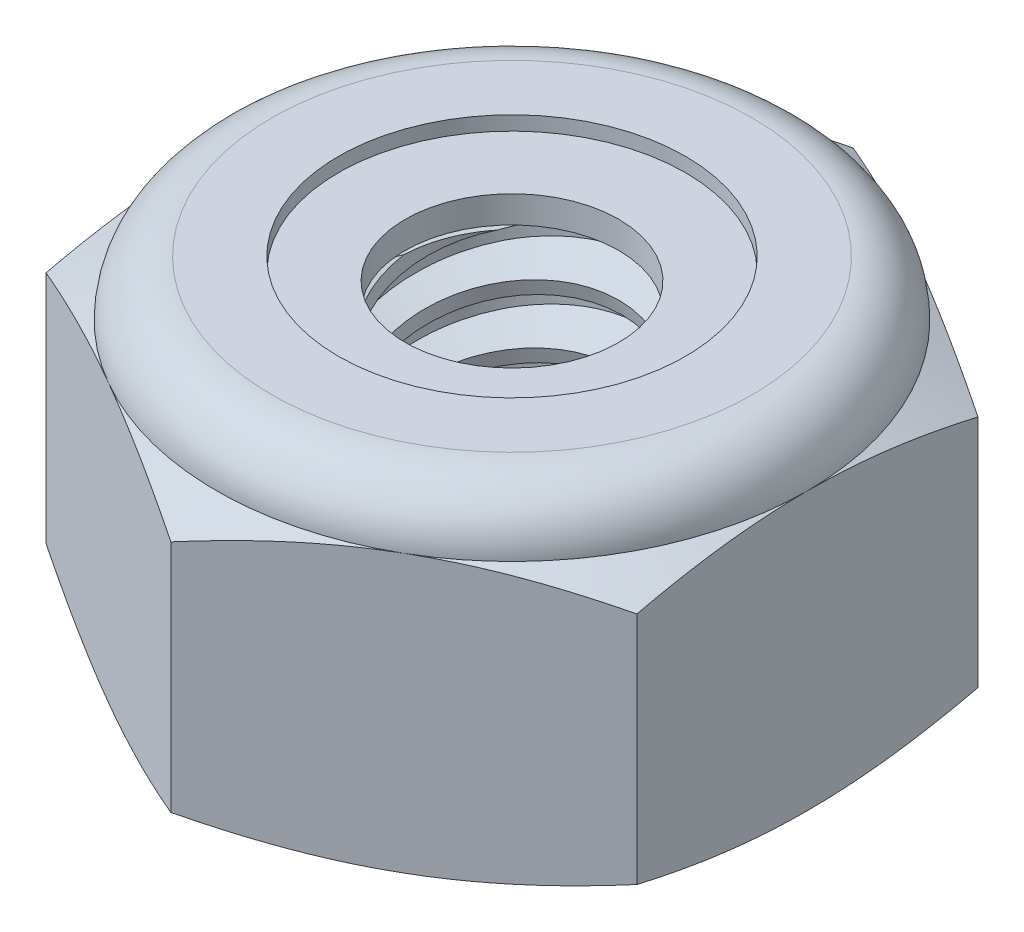
from build123d import *

# Parameters (mm, degrees)
EXTRUDE1_DEPTH       = 3.571875
SKETCH2_W            = 1.4224
SKETCH2_H            = 3.571875
LPATTERN1_COUNT      = 6
LPATTERN1_PITCH      = 0.635
LPATTERN1_COUNT_DIR2 = 2
LPATTERN1_PITCH_DIR2 = 0.635


with BuildPart() as part:
    # Sketch1 → Extrude1 (new body)
    with BuildSketch(Plane(origin=(0, 0, 0), x_dir=(1, 0, 0), z_dir=(0, 1, 0))):
        Polygon((0, 3.666174209), (-3.175, 1.833087105), (-3.175, -1.833087105), (0, -3.666174209), (3.175, -1.833087105), (3.175, 1.833087105), align=None)
    extrude(amount=EXTRUDE1_DEPTH)

    # Sketch4 → Cut-Revolve2 (revolve, cut)
    with BuildSketch(Plane(origin=(0, 0, 0), x_dir=(0, 0, -1), z_dir=(1, 0, 0))):
        Polygon((0, 3.571875), (1.4224, 3.571875), (1.147473684, 3.443674754), (1.147473684, 0.128200246), (1.4224, 0), (0, 0), align=None)
    revolve(axis=Axis((0, 3.571875, 0), (0, 1, 0)), mode=Mode.SUBTRACT)


with BuildPart() as body_2:
    # Sketch2 → Revolve1 (revolve)
    with BuildSketch(Plane(origin=(0, 0, 0), x_dir=(0, 0, -1), z_dir=(1, 0, 0))):
        with Locations((0.7112, 1.7859375)):
            Rectangle(SKETCH2_W, SKETCH2_H)
    revolve(axis=Axis((0, -1.4224, 0), (0, 1, 0)))

    # Sketch3 → Cut-Revolve1 (revolve, cut)
    with BuildSketch(Plane(origin=(0, 0, 0), x_dir=(0, 0, -1), z_dir=(1, 0, 0))):
        Polygon((1.439692084, 3.494406462), (1.560736676, 2.952126693), (1.182057853, 3.070921117), (1.147473684, 3.225858194), align=None)
    cut_revolve1 = revolve(axis=Axis((0, 3.571875, 0.152561988), (0, -0.9759815859905197, -0.21785303258717761)), mode=Mode.SUBTRACT)

    # LPattern1: Cut-Revolve1 6 × 2
    with Locations(*[Vector(0, -1, 0) * (i * LPATTERN1_PITCH) + Vector(0, 1, 0) * (j * LPATTERN1_PITCH_DIR2) for i in range(LPATTERN1_COUNT) for j in range(LPATTERN1_COUNT_DIR2) if (i, j) != (0, 0)]):
        add(cut_revolve1, mode=Mode.SUBTRACT)


with BuildPart() as part_1:
    add(part.part)

    # Combine1: cut body 2
    add(body_2.part, mode=Mode.SUBTRACT)

    # Sketch5 → Cut-Revolve3 (revolve, cut)
    with BuildSketch(Plane(origin=(0, 0, 0), x_dir=(0, 0, -1), z_dir=(1, 0, 0))):
        with BuildLine():
            Line((0, 0), (3.175, 0))
            Line((3.175, 0), (3.666174209, 0.229038295))
            Line((3.666174209, 0.229038295), (3.666174209, 2.747524205))
            Line((3.666174209, 2.747524205), (3.175, 2.9765625))
            ThreePointArc((3.175, 2.9765625), (3.000637006, 3.397512006), (2.5796875, 3.571875))
            Line((2.5796875, 3.571875), (2.5796875, 4.841875))
            Line((2.5796875, 4.841875), (4.936174209, 4.841875))
            Line((4.936174209, 4.841875), (4.936174209, -1.27))
            Line((4.936174209, -1.27), (0, -1.27))
            Line((0, -1.27), (0, 0))
        make_face()
    revolve(axis=Axis((0, 0, 0), (0, 1, 0)), mode=Mode.SUBTRACT)

    # Sketch6 → Cut-Revolve4 (revolve, cut)
    with BuildSketch(Plane(origin=(0, 0, 0), x_dir=(0, 0, -1), z_dir=(1, 0, 0))):
        with BuildLine():
            Line((0, 2.9765625), (3.0226, 2.9765625))
            ThreePointArc((3.0226, 2.9765625), (2.892873932, 3.289748932), (2.5796875, 3.419475))
            Line((2.5796875, 3.419475), (1.863580592, 3.419475))
            Line((1.863580592, 3.419475), (1.863580592, 4.841875))
            Line((1.863580592, 4.841875), (0, 4.841875))
            Line((0, 4.841875), (0, 2.9765625))
        make_face()
    revolve(axis=Axis((0, 4.841875, 0), (0, 1, 0)), mode=Mode.SUBTRACT)


with BuildPart() as body_2_2:
    # Sketch7 → Revolve2 (revolve)
    with BuildSketch(Plane(origin=(0, 0, 0), x_dir=(0, 0, -1), z_dir=(1, 0, 0))):
        with BuildLine():
            Line((1.147473684, 3.0527625), (2.938395763, 3.0527625))
            ThreePointArc((2.938395763, 3.0527625), (2.810484559, 3.261537543), (2.5796875, 3.343275))
            Line((2.5796875, 3.343275), (1.147473684, 3.343275))
            Line((1.147473684, 3.343275), (1.147473684, 3.0527625))
        make_face()
    revolve(axis=Axis((0, 3.0527625, 0), (0, 1, 0)))


solid = Compound([part_1.part, body_2_2.part])
